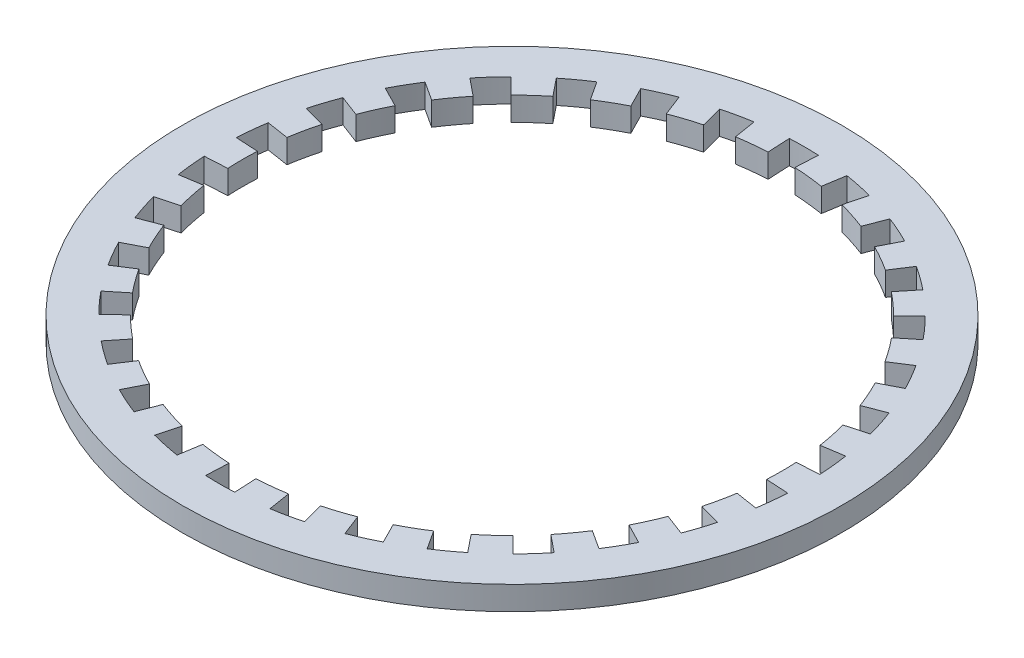
from build123d import *

# Parameters (mm, degrees)
SKETCH1_R           = 7.94
SKETCH1_R_2         = 6.5
BOSS_EXTRUDE1_DEPTH = 0.57
CUT_EXTRUDE1_DEPTH  = 12.243313569


with BuildPart() as part:
    # Sketch1 → Boss-Extrude1 (new body)
    with BuildSketch(Plane(origin=(0, 0, 0), x_dir=(1, 0, 0), z_dir=(0, 1, 0))):
        with Locations(Location((0, 0, 0), (0, 0, 270))):
            Circle(SKETCH1_R)
        with Locations(Location((0, 0, 0), (0, 0, 270))):
            Circle(SKETCH1_R_2, mode=Mode.SUBTRACT)
    extrude(amount=BOSS_EXTRUDE1_DEPTH)

    # Sketch2 → Cut-Extrude1 (cut, through all)
    with BuildSketch(Plane(origin=(0, 0.57, 0), x_dir=(1, 0, 0), z_dir=(0, 1, 0))):
        with BuildLine():
            Line((-0.35, 7.031294333), (-0.323153409, 6.491962097))
            ThreePointArc((-0.323153409, 6.491962097), (0, 6.5), (0.323153409, 6.491962097))
            Line((0.323153409, 6.491962097), (0.35, 7.031294333))
            ThreePointArc((0.35, 7.031294333), (0, 7.04), (-0.35, 7.031294333))
        make_face()
        with BuildLine():
            Line((1.804239954, 6.80487459), (1.665846548, 6.282909778))
            ThreePointArc((1.665846548, 6.282909778), (1.35142599, 6.357959405), (1.033663085, 6.417284521))
            Line((1.033663085, 6.417284521), (1.119536633, 6.950412774))
            ThreePointArc((1.119536633, 6.950412774), (1.463698303, 6.886159109), (1.804239954, 6.80487459))
        make_face()
        with BuildLine():
            Line((3.179625964, 6.281049174), (2.935734199, 5.799264152))
            ThreePointArc((2.935734199, 5.799264152), (2.64378818, 5.938045475), (2.345303541, 6.062140818))
            Line((2.345303541, 6.062140818), (2.540144143, 6.565764825))
            ThreePointArc((2.540144143, 6.565764825), (2.863425967, 6.431360022), (3.179625964, 6.281049174))
        make_face()
        with BuildLine():
            Line((4.416047062, 5.48271177), (4.077316179, 5.062162856))
            ThreePointArc((4.077316179, 5.062162856), (3.82060414, 5.258610463), (3.55444298, 5.442052472))
            Line((3.55444298, 5.442052472), (3.849735166, 5.894161446))
            ThreePointArc((3.849735166, 5.894161446), (4.138008176, 5.69547964), (4.416047062, 5.48271177))
        make_face()
        with BuildLine():
            Line((5.459465712, 4.444753552), (5.040699876, 4.103820751))
            ThreePointArc((5.040699876, 4.103820751), (4.830441366, 4.349348941), (4.608236203, 4.584120318))
            Line((4.608236203, 4.584120318), (4.991074288, 4.96495493))
            ThreePointArc((4.991074288, 4.96495493), (5.231739571, 4.710679469), (5.459465712, 4.444753552))
        make_face()
        with BuildLine():
            Line((6.264279514, 3.212538275), (5.783780801, 2.966121987))
            ThreePointArc((5.783780801, 2.966121987), (5.629165125, 3.25), (5.460627392, 3.52584011))
            Line((5.460627392, 3.52584011), (5.914279514, 3.818756058))
            ThreePointArc((5.914279514, 3.818756058), (6.096818843, 3.52), (6.264279514, 3.212538275))
        make_face()
        with BuildLine():
            Line((6.795314242, 1.839919661), (6.274082751, 1.698789459))
            ThreePointArc((6.274082751, 1.698789459), (6.181867356, 2.008610463), (6.074362961, 2.31346377))
            Line((6.074362961, 2.31346377), (6.579002346, 2.505659222))
            ThreePointArc((6.579002346, 2.505659222), (6.695437875, 2.17547964), (6.795314242, 1.839919661))
        make_face()
        with BuildLine():
            Line((7.029361129, 0.386887728), (6.490177179, 0.357211681))
            ThreePointArc((6.490177179, 0.357211681), (6.46439232, 0.679435011), (6.422619721, 0.999977963))
            Line((6.422619721, 0.999977963), (6.956191205, 1.083053055))
            ThreePointArc((6.956191205, 1.083053055), (7.001434143, 0.735880381), (7.029361129, 0.386887728))
        make_face()
        with BuildLine():
            Line((6.956191205, -1.083053055), (6.422619721, -0.999977963))
            ThreePointArc((6.422619721, -0.999977963), (6.46439232, -0.679435011), (6.490177179, -0.357211681))
            Line((6.490177179, -0.357211681), (7.029361129, -0.386887728))
            ThreePointArc((7.029361129, -0.386887728), (7.001434143, -0.735880381), (6.956191205, -1.083053055))
        make_face()
        with BuildLine():
            Line((6.579002346, -2.505659222), (6.074362961, -2.31346377))
            ThreePointArc((6.074362961, -2.31346377), (6.181867356, -2.008610463), (6.274082751, -1.698789459))
            Line((6.274082751, -1.698789459), (6.795314242, -1.839919661))
            ThreePointArc((6.795314242, -1.839919661), (6.695437875, -2.17547964), (6.579002346, -2.505659222))
        make_face()
        with BuildLine():
            Line((5.914279514, -3.818756058), (5.460627392, -3.52584011))
            ThreePointArc((5.460627392, -3.52584011), (5.629165125, -3.25), (5.783780801, -2.966121987))
            Line((5.783780801, -2.966121987), (6.264279514, -3.212538275))
            ThreePointArc((6.264279514, -3.212538275), (6.096818843, -3.52), (5.914279514, -3.818756058))
        make_face()
        with BuildLine():
            Line((4.991074288, -4.96495493), (4.608236203, -4.584120318))
            ThreePointArc((4.608236203, -4.584120318), (4.830441366, -4.349348941), (5.040699876, -4.103820751))
            Line((5.040699876, -4.103820751), (5.459465712, -4.444753552))
            ThreePointArc((5.459465712, -4.444753552), (5.231739571, -4.710679469), (4.991074288, -4.96495493))
        make_face()
        with BuildLine():
            Line((3.849735166, -5.894161446), (3.55444298, -5.442052472))
            ThreePointArc((3.55444298, -5.442052472), (3.82060414, -5.258610463), (4.077316179, -5.062162856))
            Line((4.077316179, -5.062162856), (4.416047062, -5.48271177))
            ThreePointArc((4.416047062, -5.48271177), (4.138008176, -5.69547964), (3.849735166, -5.894161446))
        make_face()
        with BuildLine():
            Line((2.540144143, -6.565764825), (2.345303541, -6.062140818))
            ThreePointArc((2.345303541, -6.062140818), (2.64378818, -5.938045475), (2.935734199, -5.799264152))
            Line((2.935734199, -5.799264152), (3.179625964, -6.281049174))
            ThreePointArc((3.179625964, -6.281049174), (2.863425967, -6.431360022), (2.540144143, -6.565764825))
        make_face()
        with BuildLine():
            Line((1.119536633, -6.950412774), (1.033663085, -6.417284521))
            ThreePointArc((1.033663085, -6.417284521), (1.35142599, -6.357959405), (1.665846548, -6.282909778))
            Line((1.665846548, -6.282909778), (1.804239954, -6.80487459))
            ThreePointArc((1.804239954, -6.80487459), (1.463698303, -6.886159109), (1.119536633, -6.950412774))
        make_face()
        with BuildLine():
            Line((-0.35, -7.031294333), (-0.323153409, -6.491962097))
            ThreePointArc((-0.323153409, -6.491962097), (0, -6.5), (0.323153409, -6.491962097))
            Line((0.323153409, -6.491962097), (0.35, -7.031294333))
            ThreePointArc((0.35, -7.031294333), (0, -7.04), (-0.35, -7.031294333))
        make_face()
        with BuildLine():
            Line((-1.804239954, -6.80487459), (-1.665846548, -6.282909778))
            ThreePointArc((-1.665846548, -6.282909778), (-1.35142599, -6.357959405), (-1.033663085, -6.417284521))
            Line((-1.033663085, -6.417284521), (-1.119536633, -6.950412774))
            ThreePointArc((-1.119536633, -6.950412774), (-1.463698303, -6.886159109), (-1.804239954, -6.80487459))
        make_face()
        with BuildLine():
            Line((-3.179625964, -6.281049174), (-2.935734199, -5.799264152))
            ThreePointArc((-2.935734199, -5.799264152), (-2.64378818, -5.938045475), (-2.345303541, -6.062140818))
            Line((-2.345303541, -6.062140818), (-2.540144143, -6.565764825))
            ThreePointArc((-2.540144143, -6.565764825), (-2.863425967, -6.431360022), (-3.179625964, -6.281049174))
        make_face()
        with BuildLine():
            Line((-4.416047062, -5.48271177), (-4.077316179, -5.062162856))
            ThreePointArc((-4.077316179, -5.062162856), (-3.82060414, -5.258610463), (-3.55444298, -5.442052472))
            Line((-3.55444298, -5.442052472), (-3.849735166, -5.894161446))
            ThreePointArc((-3.849735166, -5.894161446), (-4.138008176, -5.69547964), (-4.416047062, -5.48271177))
        make_face()
        with BuildLine():
            Line((-5.459465712, -4.444753552), (-5.040699876, -4.103820751))
            ThreePointArc((-5.040699876, -4.103820751), (-4.830441366, -4.349348941), (-4.608236203, -4.584120318))
            Line((-4.608236203, -4.584120318), (-4.991074288, -4.96495493))
            ThreePointArc((-4.991074288, -4.96495493), (-5.231739571, -4.710679469), (-5.459465712, -4.444753552))
        make_face()
        with BuildLine():
            Line((-6.264279514, -3.212538275), (-5.783780801, -2.966121987))
            ThreePointArc((-5.783780801, -2.966121987), (-5.629165125, -3.25), (-5.460627392, -3.52584011))
            Line((-5.460627392, -3.52584011), (-5.914279514, -3.818756058))
            ThreePointArc((-5.914279514, -3.818756058), (-6.096818843, -3.52), (-6.264279514, -3.212538275))
        make_face()
        with BuildLine():
            Line((-6.795314242, -1.839919661), (-6.274082751, -1.698789459))
            ThreePointArc((-6.274082751, -1.698789459), (-6.181867356, -2.008610463), (-6.074362961, -2.31346377))
            Line((-6.074362961, -2.31346377), (-6.579002346, -2.505659222))
            ThreePointArc((-6.579002346, -2.505659222), (-6.695437875, -2.17547964), (-6.795314242, -1.839919661))
        make_face()
        with BuildLine():
            Line((-7.029361129, -0.386887728), (-6.490177179, -0.357211681))
            ThreePointArc((-6.490177179, -0.357211681), (-6.46439232, -0.679435011), (-6.422619721, -0.999977963))
            Line((-6.422619721, -0.999977963), (-6.956191205, -1.083053055))
            ThreePointArc((-6.956191205, -1.083053055), (-7.001434143, -0.735880381), (-7.029361129, -0.386887728))
        make_face()
        with BuildLine():
            Line((-6.956191205, 1.083053055), (-6.422619721, 0.999977963))
            ThreePointArc((-6.422619721, 0.999977963), (-6.46439232, 0.679435011), (-6.490177179, 0.357211681))
            Line((-6.490177179, 0.357211681), (-7.029361129, 0.386887728))
            ThreePointArc((-7.029361129, 0.386887728), (-7.001434143, 0.735880381), (-6.956191205, 1.083053055))
        make_face()
        with BuildLine():
            Line((-6.579002346, 2.505659222), (-6.074362961, 2.31346377))
            ThreePointArc((-6.074362961, 2.31346377), (-6.181867356, 2.008610463), (-6.274082751, 1.698789459))
            Line((-6.274082751, 1.698789459), (-6.795314242, 1.839919661))
            ThreePointArc((-6.795314242, 1.839919661), (-6.695437875, 2.17547964), (-6.579002346, 2.505659222))
        make_face()
        with BuildLine():
            Line((-5.914279514, 3.818756058), (-5.460627392, 3.52584011))
            ThreePointArc((-5.460627392, 3.52584011), (-5.629165125, 3.25), (-5.783780801, 2.966121987))
            Line((-5.783780801, 2.966121987), (-6.264279514, 3.212538275))
            ThreePointArc((-6.264279514, 3.212538275), (-6.096818843, 3.52), (-5.914279514, 3.818756058))
        make_face()
        with BuildLine():
            Line((-4.991074288, 4.96495493), (-4.608236203, 4.584120318))
            ThreePointArc((-4.608236203, 4.584120318), (-4.830441366, 4.349348941), (-5.040699876, 4.103820751))
            Line((-5.040699876, 4.103820751), (-5.459465712, 4.444753552))
            ThreePointArc((-5.459465712, 4.444753552), (-5.231739571, 4.710679469), (-4.991074288, 4.96495493))
        make_face()
        with BuildLine():
            Line((-3.849735166, 5.894161446), (-3.55444298, 5.442052472))
            ThreePointArc((-3.55444298, 5.442052472), (-3.82060414, 5.258610463), (-4.077316179, 5.062162856))
            Line((-4.077316179, 5.062162856), (-4.416047062, 5.48271177))
            ThreePointArc((-4.416047062, 5.48271177), (-4.138008176, 5.69547964), (-3.849735166, 5.894161446))
        make_face()
        with BuildLine():
            Line((-2.540144143, 6.565764825), (-2.345303541, 6.062140818))
            ThreePointArc((-2.345303541, 6.062140818), (-2.64378818, 5.938045475), (-2.935734199, 5.799264152))
            Line((-2.935734199, 5.799264152), (-3.179625964, 6.281049174))
            ThreePointArc((-3.179625964, 6.281049174), (-2.863425967, 6.431360022), (-2.540144143, 6.565764825))
        make_face()
        with BuildLine():
            Line((-1.119536633, 6.950412774), (-1.033663085, 6.417284521))
            ThreePointArc((-1.033663085, 6.417284521), (-1.35142599, 6.357959405), (-1.665846548, 6.282909778))
            Line((-1.665846548, 6.282909778), (-1.804239954, 6.80487459))
            ThreePointArc((-1.804239954, 6.80487459), (-1.463698303, 6.886159109), (-1.119536633, 6.950412774))
        make_face()
    extrude(amount=-CUT_EXTRUDE1_DEPTH, mode=Mode.SUBTRACT)


solid = part.part
